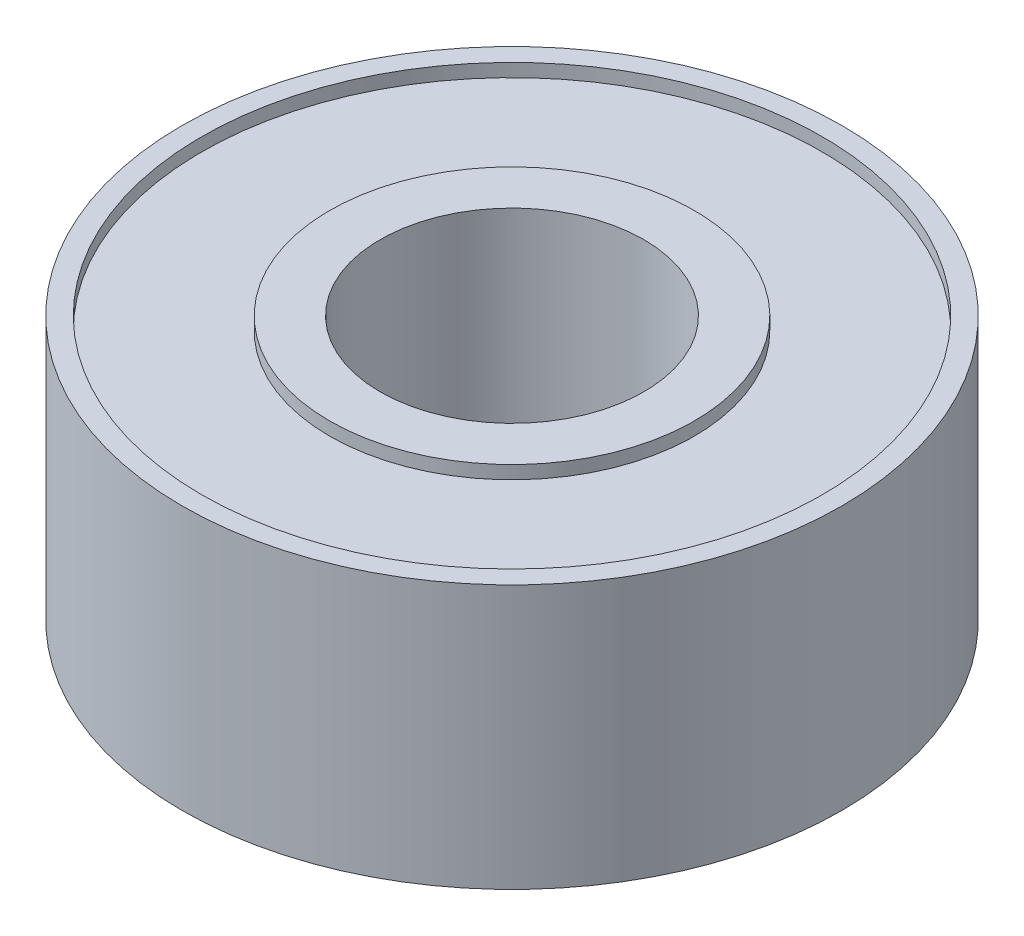
from build123d import *

# Parameters (mm, degrees)
SKETCH_1_R          = 2.5
SKETCH_1_R_2        = 1
EXTRUDE_1_DEPTH     = 1
SKETCH_2_R          = 2.352418258
SKETCH_2_R_2        = 1.382454344
CUT_EXTRUDE_1_DEPTH = 0.1


with BuildPart() as part:
    # 草图1 → 凸台-拉伸1 (new, symmetric)
    with BuildSketch(Plane(origin=(0, 0, 0), x_dir=(1, 0, 0), z_dir=(0, 1, 0))):
        with Locations(Location((0, 0, 0), (0, 0, 270))):
            Circle(SKETCH_1_R)
        with Locations(Location((0, 0, 0), (0, 0, 270))):
            Circle(SKETCH_1_R_2, mode=Mode.SUBTRACT)
    extrude(amount=EXTRUDE_1_DEPTH, both=True)

    # 草图2 → 切除-拉伸1 (cut)
    with BuildSketch(Plane(origin=(0, 1, 0), x_dir=(1, 0, 0), z_dir=(0, 1, 0))):
        with Locations(Location((0, 0, 0), (0, 0, 270))):
            Circle(SKETCH_2_R)
        with Locations(Location((0, 0, 0), (0, 0, 270))):
            Circle(SKETCH_2_R_2, mode=Mode.SUBTRACT)
    cut_extrude_1 = extrude(amount=-CUT_EXTRUDE_1_DEPTH, mode=Mode.SUBTRACT)

    # 镜向1: 切除-拉伸1 across plane
    add(cut_extrude_1.mirror(Plane.ZX), mode=Mode.SUBTRACT)


solid = part.part
